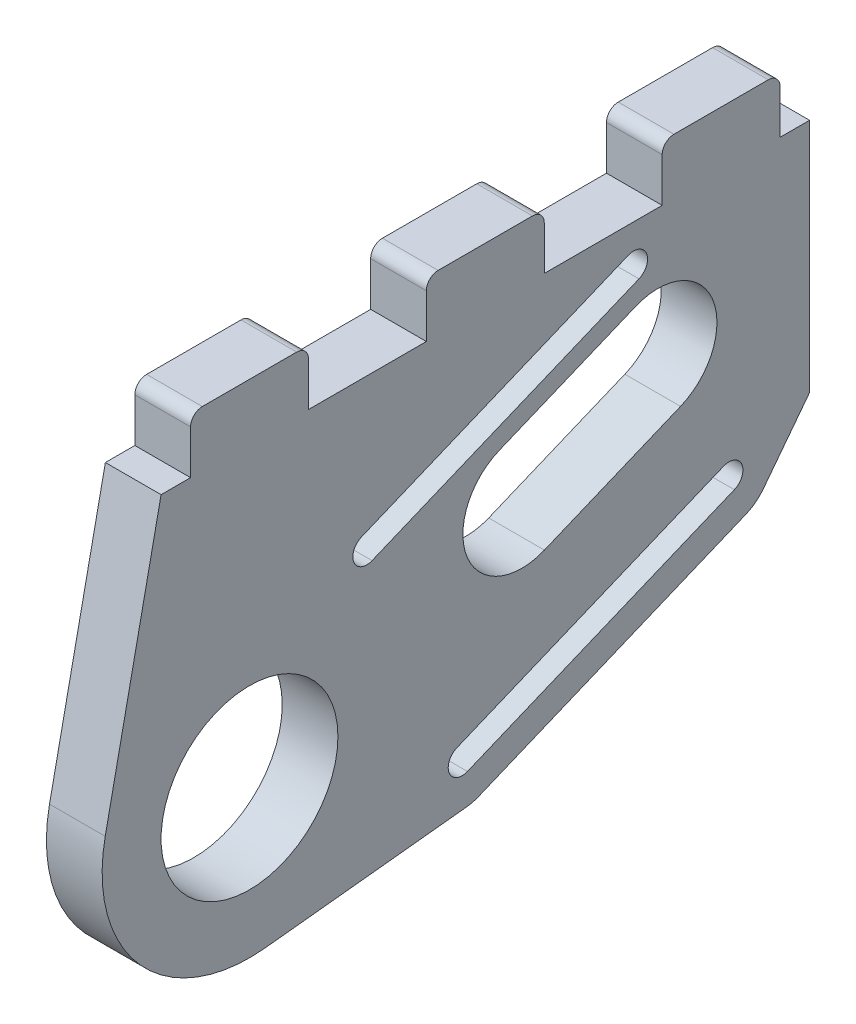
from build123d import *

# Parameters (mm, degrees)
SKETCH1_R              = 9.525
BOSS_EXTRUDE1_DEPTH    = 3
CUT_EXTRUDE1_DEPTH     = 69.596761039
SKETCH3_W              = 6
SKETCH3_H              = 12.7
BOSS_EXTRUDE2_DEPTH    = 6
FILLET1_R              = 1.27
LPATTERN1_COUNT        = 3
LPATTERN1_PITCH        = 25.4
FILLET1_OF_LPATTERN1_R = 1.27


with BuildPart() as part:
    # Sketch1 → Boss-Extrude1 (new, symmetric)
    with BuildSketch(Plane(origin=(0, 0, 0), x_dir=(0, 0, -1), z_dir=(1, 0, 0))):
        with BuildLine():
            Line((-15.540953853, 3.23950279), (-9.525, 32.1))
            Line((-9.525, 32.1), (60.325, 32.1))
            Line((60.325, 32.1), (60.325, -15.875))
            Line((60.325, -15.875), (0, -15.875))
            ThreePointArc((0, -15.875), (-12.317522717, -10.014702148), (-15.540953853, 3.23950279))
        make_face()
        Circle(SKETCH1_R, mode=Mode.SUBTRACT)
    extrude(amount=BOSS_EXTRUDE1_DEPTH, both=True)

    # Sketch2 → Cut-Extrude1 (cut, through all)
    with BuildSketch(Plane(origin=(3, 0, 0), x_dir=(0, 0, -1), z_dir=(1, 0, 0))):
        with BuildLine():
            Line((1.676231888, -15.786255783), (23.396510982, -13.47993154))
            ThreePointArc((23.396510982, -13.47993154), (24.056064004, -13.361605673), (24.691925535, -13.150202478))
            Line((24.691925535, -13.150202478), (53.43843719, -1.24300748))
            ThreePointArc((53.43843719, -1.24300748), (54.494953994, -0.633102763), (55.357708418, 0.229374093))
            Line((55.357708418, 0.229374093), (60.325, 6.7))
            Line((60.325, 6.7), (60.325, -15.875))
            Line((60.325, -15.875), (0, -15.875))
            ThreePointArc((0, -15.875), (0.839289711, -15.852798421), (1.676231888, -15.786255783))
        make_face()
        with BuildLine():
            Line((26.903135362, 18.016834009), (41.56972294, 24.091933498))
            ThreePointArc((41.56972294, 24.091933498), (49.866397767, 20.655338262), (46.429802531, 12.358663435))
            Line((46.429802531, 12.358663435), (31.763214953, 6.283563946))
            ThreePointArc((31.763214953, 6.283563946), (23.466540126, 9.720159182), (26.903135362, 18.016834009))
        make_face()
        with BuildLine():
            Line((22.328855341, -7.445246365), (51.075366995, 4.461948633))
            ThreePointArc((51.075366995, 4.461948633), (53.035211442, 3.650154483), (52.223417292, 1.690310036))
            Line((52.223417292, 1.690310036), (23.476905638, -10.216884962))
            ThreePointArc((23.476905638, -10.216884962), (21.51706119, -9.405090812), (22.328855341, -7.445246365))
        make_face()
        with BuildLine():
            Line((12.055034553, 17.357951117), (40.801546208, 29.265146115))
            ThreePointArc((40.801546208, 29.265146115), (42.761390655, 28.453351965), (41.949596505, 26.493507518))
            Line((41.949596505, 26.493507518), (13.203084851, 14.58631252))
            ThreePointArc((13.203084851, 14.58631252), (11.243240403, 15.39810667), (12.055034553, 17.357951117))
        make_face()
    extrude(amount=-CUT_EXTRUDE1_DEPTH, mode=Mode.SUBTRACT)

    # Sketch3 → Boss-Extrude2 (add)
    with BuildSketch(Plane(origin=(0, 32.1, 0), x_dir=(1, 0, 0), z_dir=(0, 1, 0))):
        Rectangle(SKETCH3_W, SKETCH3_H)
    boss_extrude2 = extrude(amount=BOSS_EXTRUDE2_DEPTH)

    # Fillet1
    fillet1_edges = [part.edges().sort_by_distance(p)[0] for p in [
        (0, 38.1, -6.35),
        (0, 38.1, 6.35),
    ]]
    fillet(fillet1_edges, radius=FILLET1_R)

    # LPattern1: Boss-Extrude2 ×3
    with Locations(*[(0, 0, -i * LPATTERN1_PITCH) for i in range(1, LPATTERN1_COUNT)]):
        add(boss_extrude2)

    # Fillet1 of LPattern1
    fillet1_of_lpattern1_edges = [part.edges().sort_by_distance(p)[0] for p in [
        (0, 38.1, -31.75),
        (0, 38.1, -19.05),
        (0, 38.1, -57.15),
        (0, 38.1, -44.45),
    ]]
    fillet(fillet1_of_lpattern1_edges, radius=FILLET1_OF_LPATTERN1_R)


solid = part.part
